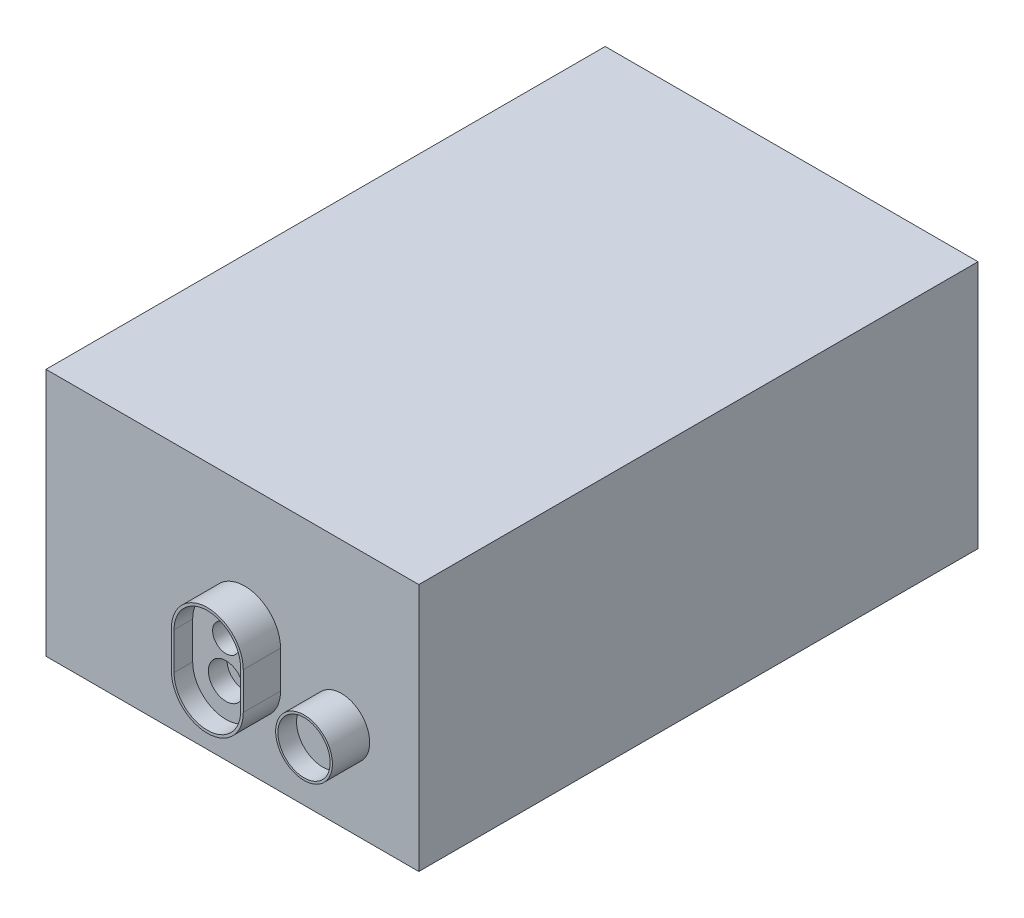
from build123d import *

# Parameters (mm, degrees)
SKETCH1_W           = 300
SKETCH1_H           = 200
BOSS_EXTRUDE1_DEPTH = 450
SHELL1_T            = 10
SKETCH2_R           = 22.84898586
SKETCH2_R_2         = 21.039403667
BOSS_EXTRUDE2_DEPTH = 30
SKETCH5_R           = 10.76282056
SKETCH5_R_2         = 14.175471805
BOSS_EXTRUDE3_DEPTH = 15
SKETCH6_R           = 21.039403667
BOSS_EXTRUDE4_DEPTH = 15


with BuildPart() as part:
    # Sketch1 → Boss-Extrude1 (new body)
    with BuildSketch(Plane.XY):
        Rectangle(SKETCH1_W, SKETCH1_H)
    extrude(amount=BOSS_EXTRUDE1_DEPTH)

    # Shell1 (no face opened: a closed hollow body)
    add(offset(amount=-SHELL1_T, mode=Mode.PRIVATE), mode=Mode.SUBTRACT)

    # Sketch2 → Boss-Extrude2 (add)
    # profile 1 of 2: a face of its own
    with BuildSketch(Plane.XY.offset(450)):
        with Locations((87.640110274, -29.828388409)):
            Circle(SKETCH2_R)
        with Locations((87.640110274, -29.828388409)):
            Circle(SKETCH2_R_2, mode=Mode.SUBTRACT)
    # profile 2 of 2: a face of its own
    with BuildSketch(Plane.XY.offset(450)):
        with BuildLine():
            Line((-19.065567849, 0), (-19.065567849, -29.828388409))
            ThreePointArc((-19.065567849, -29.828388409), (9.840293083, -58.734249341), (38.746154016, -29.828388409))
            Line((38.746154016, -29.828388409), (38.746154016, 0))
            ThreePointArc((38.746154016, 0), (9.840293083, 28.905860932), (-19.065567849, 0))
        make_face()
        with BuildLine():
            Line((-16.964069854, 0), (-16.964069854, -29.828388409))
            ThreePointArc((-16.964069854, -29.828388409), (9.840293083, -56.632751347), (36.644656021, -29.828388409))
            Line((36.644656021, -29.828388409), (36.644656021, 0))
            ThreePointArc((36.644656021, 0), (9.840293083, 26.804362938), (-16.964069854, 0))
        make_face(mode=Mode.SUBTRACT)
    extrude(amount=BOSS_EXTRUDE2_DEPTH)

    # Sketch5 → Boss-Extrude3 (add)
    with BuildSketch(Plane.XY.offset(450)):
        with BuildLine():
            Line((-16.964069854, 0), (-16.964069854, -29.828388409))
            ThreePointArc((-16.964069854, -29.828388409), (9.840293083, -56.632751347), (36.644656021, -29.828388409))
            Line((36.644656021, -29.828388409), (36.644656021, 0))
            ThreePointArc((36.644656021, 0), (9.840293083, 26.804362938), (-16.964069854, 0))
        make_face()
        with Locations((9.840293083, 0)):
            Circle(SKETCH5_R, mode=Mode.SUBTRACT)
        with Locations((9.840293083, -29.828388409)):
            Circle(SKETCH5_R_2, mode=Mode.SUBTRACT)
    extrude(amount=BOSS_EXTRUDE3_DEPTH)

    # Sketch6 → Boss-Extrude4 (add)
    with BuildSketch(Plane.XY.offset(450)):
        with Locations((87.640110274, -29.828388409)):
            Circle(SKETCH6_R)
    extrude(amount=BOSS_EXTRUDE4_DEPTH)


solid = part.part
